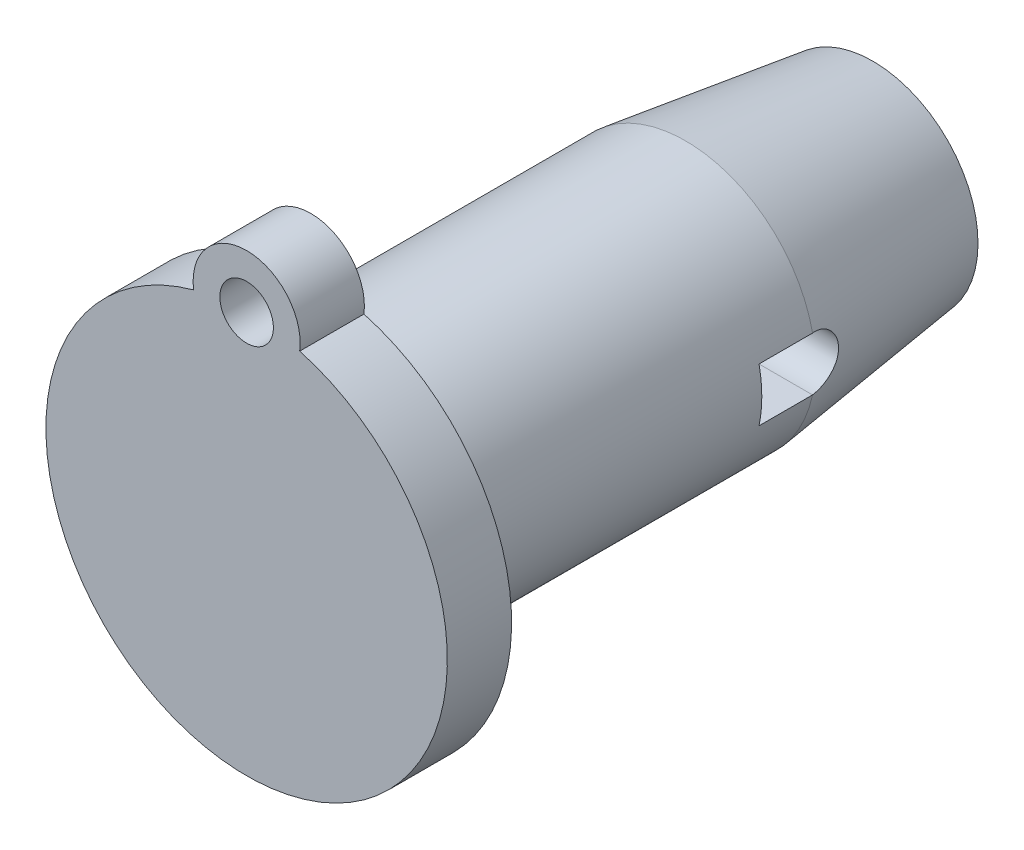
from build123d import *

# Parameters (mm, degrees)
SKETCH_1_R          = 37.5
EXTRUDE_1_DEPTH     = 12
SKETCH_2_R          = 24.25
EXTRUDE_2_DEPTH     = 105
CHAMFER_1_SIZE      = 35
CHAMFER_1_SIZE2     = 4.607837416
CUT_EXTRUDE_3_DEPTH = 178.024009671
SKETCH_6_R          = 10
EXTRUDE_4_DEPTH     = 12
SKETCH_7_R          = 5
CUT_EXTRUDE_5_DEPTH = 122.191996522


with BuildPart() as part:
    # 草图1 → 拉伸1 (new body)
    with BuildSketch(Plane.XY):
        Circle(SKETCH_1_R)
    extrude(amount=EXTRUDE_1_DEPTH)

    # 草图2 → 拉伸2 (add)
    with BuildSketch(Plane(origin=(0, 0, 0), x_dir=(-1, 0, 0), z_dir=(0, 0, -1))):
        with Locations(Location((0, 0, 0), (0, 0, 180))):
            Circle(SKETCH_2_R)
    extrude(amount=EXTRUDE_2_DEPTH)

    # 倒角1
    chamfer_1_edges = [part.edges().sort_by_distance(p)[0] for p in [
        (-24.25, 0, -105),
    ]]
    chamfer_1_side = [part.faces().sort_by_distance(p)[0] for p in [
        (-24.25, 0, -52.5),
    ]]
    chamfer(chamfer_1_edges, length=CHAMFER_1_SIZE, length2=CHAMFER_1_SIZE2, reference=chamfer_1_side[0])

    # 草图3 → 拉伸3 (cut, through all)
    with BuildSketch(Plane(origin=(100, 0, 0), x_dir=(0, 0, -1), z_dir=(1, 0, 0))):
        with BuildLine():
            Line((60, 5), (70, 5))
            ThreePointArc((70, 5), (75, 0), (70, -5))
            Line((70, -5), (60, -5))
            Line((60, -5), (60, 5))
        make_face()
    extrude(amount=-CUT_EXTRUDE_3_DEPTH, mode=Mode.SUBTRACT)

    # 草图6 → 拉伸4 (add)
    with BuildSketch(Plane(origin=(0, 0, 0), x_dir=(-1, 0, 0), z_dir=(0, 0, -1))):
        with Locations((0, 37.5)):
            Circle(SKETCH_6_R)
    extrude(amount=-EXTRUDE_4_DEPTH)

    # 草图7 → 拉伸5 (cut, through all)
    with BuildSketch(Plane(origin=(0, 0, 0), x_dir=(-1, 0, 0), z_dir=(0, 0, -1))):
        with Locations((0, 37.5)):
            Circle(SKETCH_7_R)
    extrude(amount=-CUT_EXTRUDE_5_DEPTH, mode=Mode.SUBTRACT)


solid = part.part
